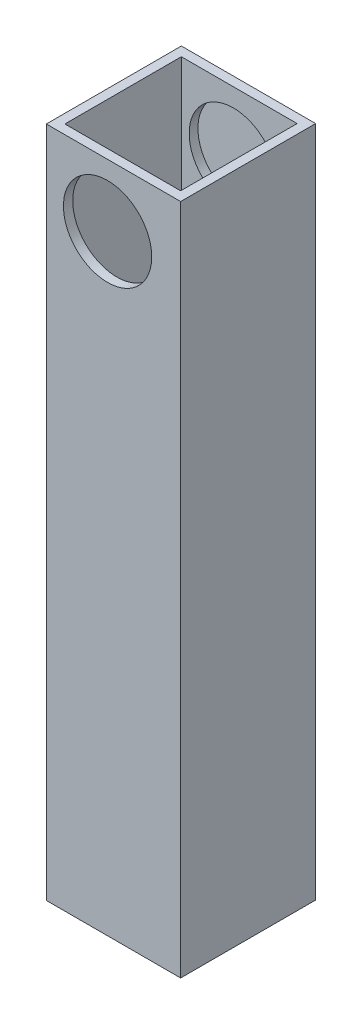
from build123d import *

# Parameters (mm, degrees)
SKETCH1_W           = 25.366424343
SKETCH1_H           = 25.503811798
BOSS_EXTRUDE1_DEPTH = 127
SKETCH2_R           = 8.338941436
CUT_EXTRUDE1_DEPTH  = 25.4
SKETCH3_W           = 21.861224343
SKETCH3_H           = 21.998611798
CUT_EXTRUDE2_DEPTH  = 127


with BuildPart() as part:
    # Sketch1 → Boss-Extrude1 (new body)
    with BuildSketch(Plane(origin=(0, 0, 0), x_dir=(1, 0, 0), z_dir=(0, 1, 0))):
        with Locations((12.683212172, -12.751905899)):
            Rectangle(SKETCH1_W, SKETCH1_H)
    extrude(amount=BOSS_EXTRUDE1_DEPTH)

    # Sketch2 → Cut-Extrude1 (cut)
    with BuildSketch(Plane.XY.offset(25.503811798)):
        with Locations((11.568608199, 115.201083313)):
            Circle(SKETCH2_R)
    extrude(amount=-CUT_EXTRUDE1_DEPTH, mode=Mode.SUBTRACT)

    # Sketch3 → Cut-Extrude2 (cut)
    with BuildSketch(Plane(origin=(0, 127, 0), x_dir=(1, 0, 0), z_dir=(0, 1, 0))):
        with Locations((12.683212172, -12.751905899)):
            Rectangle(SKETCH3_W, SKETCH3_H)
    extrude(amount=-CUT_EXTRUDE2_DEPTH, mode=Mode.SUBTRACT)


solid = part.part
